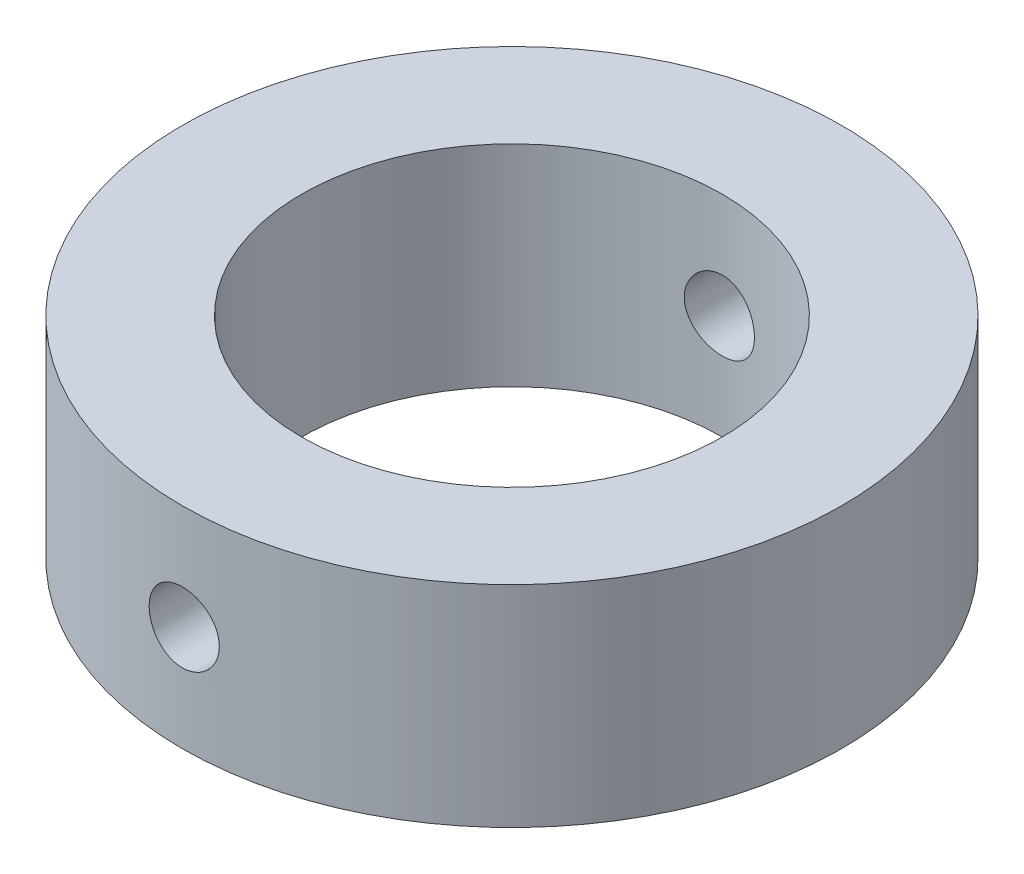
from build123d import *

# Parameters (mm, degrees)
SKETCH_1_R               = 23.5
SKETCH_1_R_2             = 15
EXTRUDE_1_DEPTH          = 15
CUT_EXTRUDE_1_DEPTH      = 46
CUT_EXTRUDE_1_DEPTH_BACK = 44
SKETCH_2_R               = 2.5


with BuildPart() as part:
    # Эскиз1 → Бобышка-Вытянуть1 (new body)
    with BuildSketch(Plane(origin=(0, 0, 0), x_dir=(1, 0, 0), z_dir=(0, 1, 0))):
        with Locations(Location((0, 0, 0), (0, 0, 270))):
            Circle(SKETCH_1_R)
        with Locations(Location((0, 0, 0), (0, 0, 270))):
            Circle(SKETCH_1_R_2, mode=Mode.SUBTRACT)
    extrude(amount=EXTRUDE_1_DEPTH)

    # Эскиз2 → Вырез-Вытянуть1 (cut, two sides: drawn at the far end of the back side and taken through both)
    with BuildSketch(Plane.XY.offset(-CUT_EXTRUDE_1_DEPTH_BACK)):
        with Locations(Location((0, 7.5, 0), (0, 0, 180))):
            Circle(SKETCH_2_R)
    extrude(amount=CUT_EXTRUDE_1_DEPTH + CUT_EXTRUDE_1_DEPTH_BACK, mode=Mode.SUBTRACT)


solid = part.part
